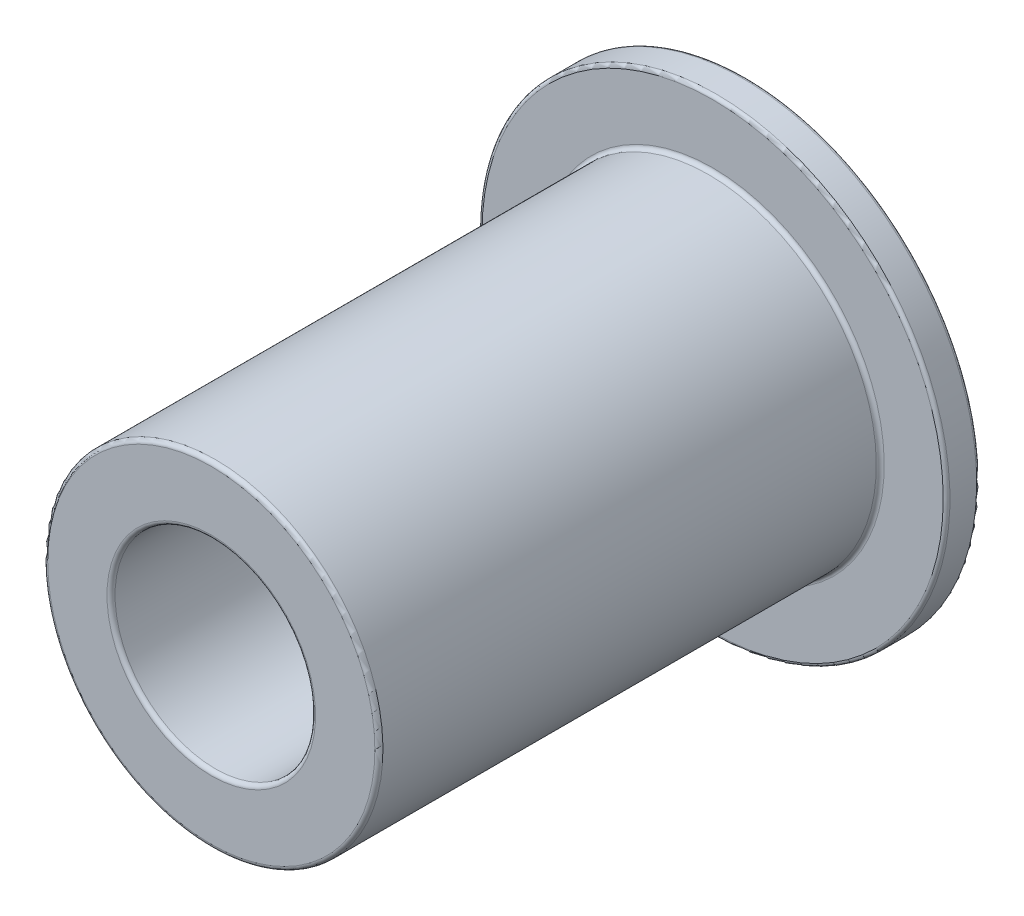
from build123d import *

# Parameters (mm, degrees)
FILLET1_R = 0.15875
FILLET2_R = 0.192024
FILLET3_R = 0.188976


with BuildPart() as part:
    # Sketch2 → Revolve1 (revolve)
    with BuildSketch(Plane(origin=(0, 0, 0), x_dir=(0, 0, -1), z_dir=(1, 0, 0)), mode=Mode.PRIVATE) as revolve1_sk:
        Polygon((-12.7, 4.7625), (12.7, 4.7625), (12.7, 11.1125), (11.1125, 11.1125), (11.1125, 7.9629), (-12.7, 7.9629), align=None)
    revolve(revolve1_sk.sketch.rotate(Axis((0, 0, 12.7), (0, 0, -1)), 180), axis=Axis((0, 0, 12.7), (0, 0, -1)))

    # Fillet1
    fillet1_edges = [part.edges().sort_by_distance(p)[0] for p in [
        (0, 11.1125, -11.1125),
        (0, 11.1125, -12.7),
    ]]
    fillet(fillet1_edges, radius=FILLET1_R)

    # Fillet2
    fillet2_edges = [part.edges().sort_by_distance(p)[0] for p in [
        (0, 7.9629, 12.7),
        (0, 4.7625, -12.7),
        (0, 4.7625, 12.7),
    ]]
    fillet(fillet2_edges, radius=FILLET2_R)

    # Fillet3
    fillet3_edges = [part.edges().sort_by_distance(p)[0] for p in [
        (0, 7.9629, -11.1125),
    ]]
    fillet(fillet3_edges, radius=FILLET3_R)


solid = part.part
